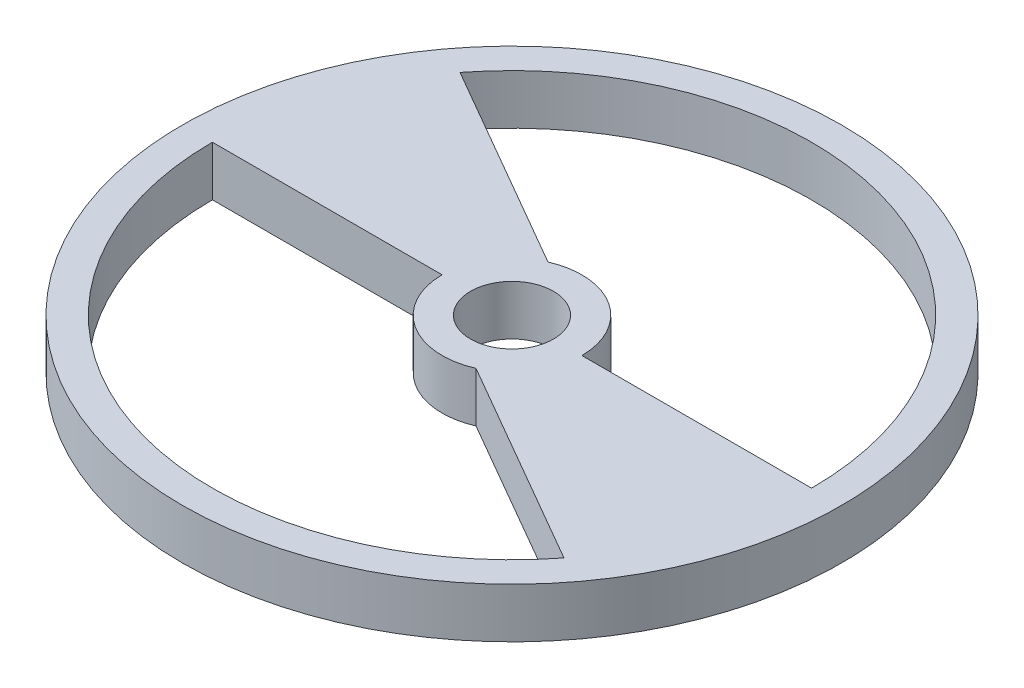
from build123d import *

# Parameters (mm, degrees)
SKETCH1_R           = 16.5
SKETCH1_R_2         = 2.075
BOSS_EXTRUDE1_DEPTH = 2.5


with BuildPart() as part:
    # Sketch1 → Boss-Extrude1 (new body)
    with BuildSketch(Plane(origin=(0, 0, 0), x_dir=(1, 0, 0), z_dir=(0, 1, 0))):
        with Locations(Location((0, 0, 0), (0, 0, 270))):
            Circle(SKETCH1_R)
        with Locations(Location((0, 0, 0), (0, 0, 270))):
            Circle(SKETCH1_R_2, mode=Mode.SUBTRACT)
        with BuildLine():
            Line((-3.5, 0), (-15, 0))
            ThreePointArc((-15, 0), (-4.877508592, -14.1848479), (11.827987991, -9.224895668))
            Line((11.827987991, -9.224895668), (1.403459084, -3.206291097))
            ThreePointArc((1.403459084, -3.206291097), (-1.915449452, -2.92934351), (-3.5, 0))
        make_face(mode=Mode.SUBTRACT)
        with BuildLine():
            Line((-11.827987991, 9.224895668), (-1.403459084, 3.206291097))
            ThreePointArc((-1.403459084, 3.206291097), (1.915449452, 2.92934351), (3.5, 0))
            Line((3.5, 0), (15, 0))
            ThreePointArc((15, 0), (4.877508592, 14.1848479), (-11.827987991, 9.224895668))
        make_face(mode=Mode.SUBTRACT)
    extrude(amount=BOSS_EXTRUDE1_DEPTH)


solid = part.part
